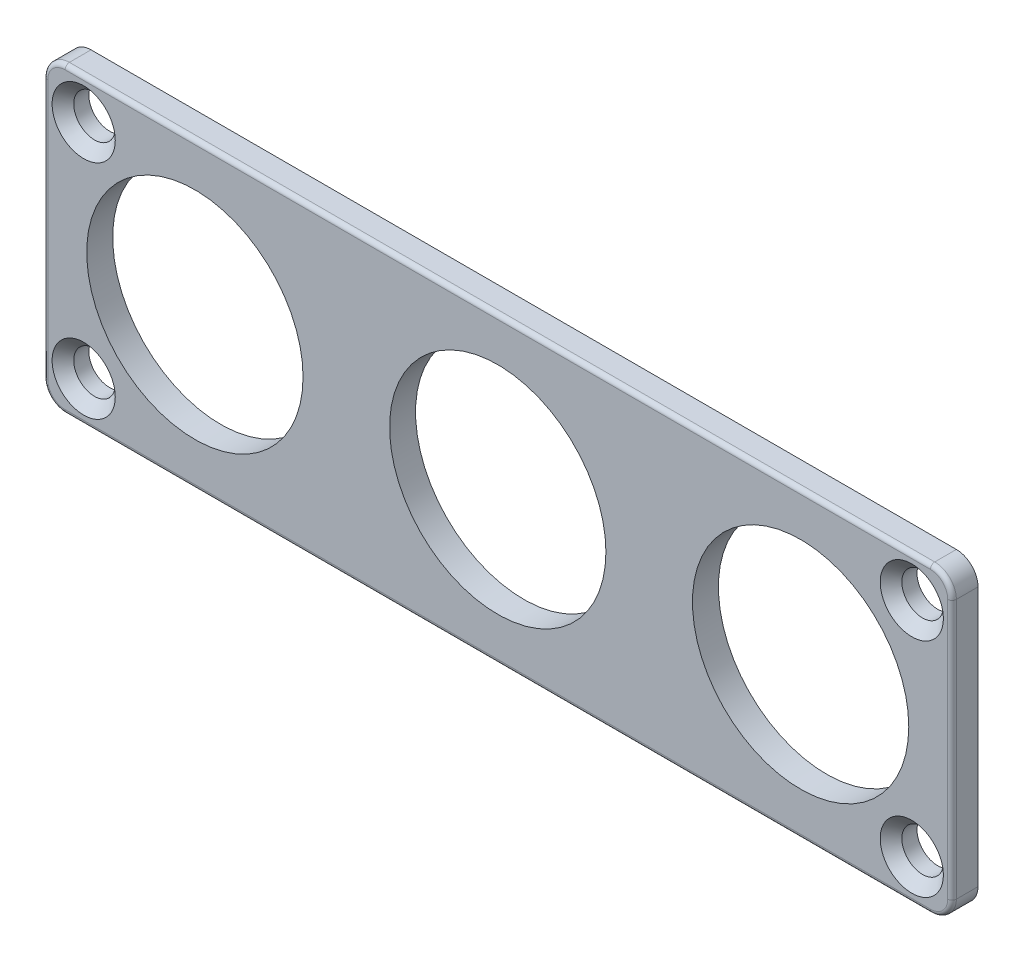
from build123d import *

# Parameters (mm, degrees)
SKETCH2_W                      = 53.34
SKETCH2_H                      = 17.780149528
BOSS_EXTRUDE1_DEPTH            = 1.524
F_2_CLEARANCE_HOLE1_AT_2_COUNT = 2
F_2_CLEARANCE_HOLE1_AT_2_PITCH = 13.038661485
F_2_CLEARANCE_HOLE1_AT_3_COUNT = 2
F_2_CLEARANCE_HOLE1_AT_3_PITCH = 50.333486658
F_2_CLEARANCE_HOLE1_AT_4_COUNT = 2
F_2_CLEARANCE_HOLE1_AT_4_PITCH = 48.615359567
FILLET1_R                      = 1.27
CUT_EXTRUDE1_REACH             = 30.154
SKETCH6_R                      = 6.35
FILLET2_R                      = 0.254


with BuildPart() as part:
    # Sketch2 → Boss-Extrude1 (new body)
    with BuildSketch(Plane.XY):
        Rectangle(SKETCH2_W, SKETCH2_H)
    extrude(amount=-BOSS_EXTRUDE1_DEPTH)

    # Sketch4 → #2 Clearance Hole1 (revolve, cut)
    with BuildSketch(Plane(origin=(-24.307679783, 6.519330742, 0), x_dir=(0, -1, 0), z_dir=(1, 0, 0))):
        Polygon((0, 0), (0, 1.524), (1.2192, 1.524), (1.2192, 0.635), (1.8542, 0), align=None)
    f_2_clearance_hole1 = revolve(axis=Axis((-24.307679783, 6.519330742, 6.35), (0, 0, -1)), mode=Mode.SUBTRACT)

    # #2 Clearance Hole1 at 2: #2 Clearance Hole1 ×2
    with Locations(*[(0, -i * F_2_CLEARANCE_HOLE1_AT_2_PITCH, 0) for i in range(1, F_2_CLEARANCE_HOLE1_AT_2_COUNT)]):
        add(f_2_clearance_hole1, mode=Mode.SUBTRACT)

    # #2 Clearance Hole1 at 3: #2 Clearance Hole1 ×2
    with Locations(*[Vector(0.9658651286657962, -0.25904546556040114, 0) * (i * F_2_CLEARANCE_HOLE1_AT_3_PITCH) for i in range(1, F_2_CLEARANCE_HOLE1_AT_3_COUNT)]):
        add(f_2_clearance_hole1, mode=Mode.SUBTRACT)

    # #2 Clearance Hole1 at 4: #2 Clearance Hole1 ×2
    with Locations(*[(i * F_2_CLEARANCE_HOLE1_AT_4_PITCH, 0, 0) for i in range(1, F_2_CLEARANCE_HOLE1_AT_4_COUNT)]):
        add(f_2_clearance_hole1, mode=Mode.SUBTRACT)

    # Fillet1
    fillet1_edges = [part.edges().sort_by_distance(p)[0] for p in [
        (-26.67, 8.890074764, -0.762),
        (26.67, 8.890074764, -0.762),
        (26.67, -8.890074764, -0.762),
        (-26.67, -8.890074764, -0.762),
    ]]
    fillet(fillet1_edges, radius=FILLET1_R)

    # Sketch6 → Cut-Extrude1 (cut, up to next)
    with BuildSketch(Plane.XY, mode=Mode.PRIVATE) as cut_extrude1_sk1:
        Circle(SKETCH6_R)
    cut_extrude1_tool1 = extrude(cut_extrude1_sk1.sketch, amount=-CUT_EXTRUDE1_REACH, mode=Mode.PRIVATE) & part.part
    # Sketch6 → Cut-Extrude1 (cut, up to next)
    with BuildSketch(Plane.XY, mode=Mode.PRIVATE) as cut_extrude1_sk2:
        with Locations((-17.78, 0)):
            Circle(SKETCH6_R)
    cut_extrude1_tool2 = extrude(cut_extrude1_sk2.sketch, amount=-CUT_EXTRUDE1_REACH, mode=Mode.PRIVATE) & part.part
    # Sketch6 → Cut-Extrude1 (cut, up to next)
    with BuildSketch(Plane.XY, mode=Mode.PRIVATE) as cut_extrude1_sk3:
        with Locations((17.779999999, -0.00017224)):
            Circle(SKETCH6_R)
    cut_extrude1_tool3 = extrude(cut_extrude1_sk3.sketch, amount=-CUT_EXTRUDE1_REACH, mode=Mode.PRIVATE) & part.part
    add(cut_extrude1_tool1.solids().sort_by_distance((0, 0, 0))[0], mode=Mode.SUBTRACT)
    add(cut_extrude1_tool2.solids().sort_by_distance((-17.78, 0, 0))[0], mode=Mode.SUBTRACT)
    add(cut_extrude1_tool3.solids().sort_by_distance((17.78, -0.000172, 0))[0], mode=Mode.SUBTRACT)

    # Fillet2
    fillet2_edges = [part.edges().sort_by_distance(p)[0] for p in [
        (0, 8.890074764, 0),
        (-26.67, 0, 0),
        (0, -8.890074764, 0),
        (26.67, 0, 0),
        (-26.298025612, -8.518100377, 0),
        (26.298025612, -8.518100377, 0),
        (26.298025612, 8.518100377, 0),
        (-26.298025612, 8.518100377, 0),
    ]]
    fillet(fillet2_edges, radius=FILLET2_R)


solid = part.part
